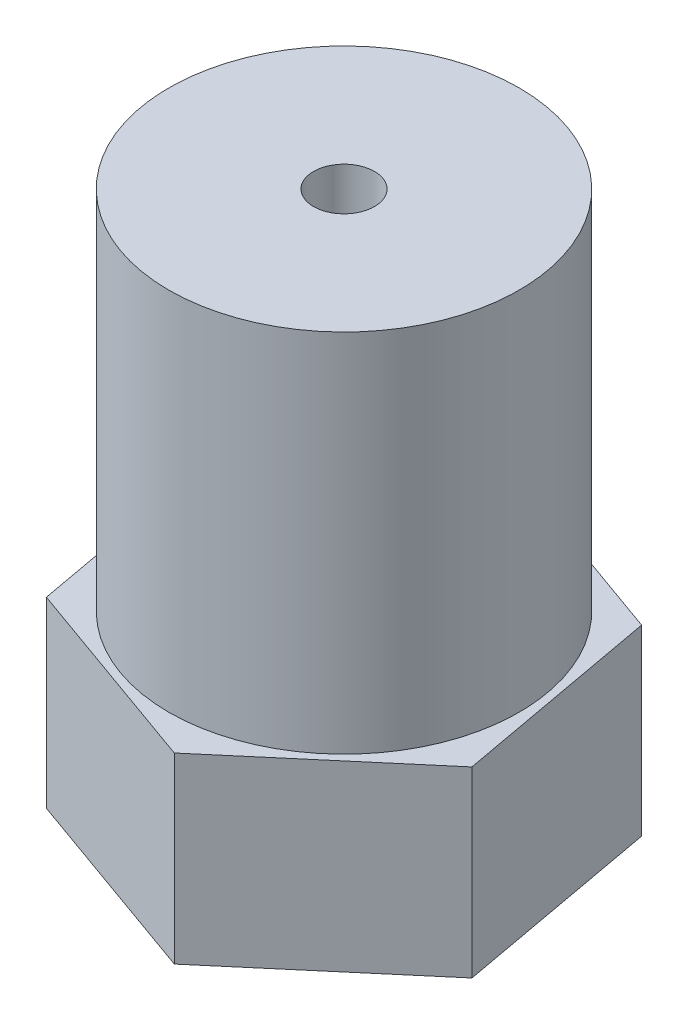
from build123d import *

# Parameters (mm, degrees)
EXTRUDE_1_DEPTH     = 6
SKETCH_2_R          = 2
CUT_EXTRUDE_1_DEPTH = 6
SKETCH_3_R          = 5.75
EXTRUDE_2_DEPTH     = 12
SKETCH_4_R          = 1
CUT_EXTRUDE_2_DEPTH = 12


with BuildPart() as part:
    # 草图1 → 凸台-拉伸1 (new body)
    with BuildSketch(Plane(origin=(0, 0, 0), x_dir=(1, 0, 0), z_dir=(0, 1, 0))):
        Polygon((5.280239472, 4.488203551), (-1.246778557, 6.816923297), (-6.527018029, 2.328719745), (-5.280239472, -4.488203551), (1.246778557, -6.816923297), (6.527018029, -2.328719745), align=None)
    extrude(amount=EXTRUDE_1_DEPTH)

    # 草图2 → 切除-拉伸1 (cut)
    with BuildSketch(Plane(origin=(0, 6, 0), x_dir=(1, 0, 0), z_dir=(0, 1, 0))):
        with Locations(Location((0, 0, 0), (0, 0, 270))):
            Circle(SKETCH_2_R)
    extrude(amount=-CUT_EXTRUDE_1_DEPTH, mode=Mode.SUBTRACT)

    # 草图3 → 凸台-拉伸2 (add)
    with BuildSketch(Plane(origin=(0, 6, 0), x_dir=(1, 0, 0), z_dir=(0, 1, 0))):
        with Locations(Location((0, 0, 0), (0, 0, 270))):
            Circle(SKETCH_3_R)
    extrude(amount=EXTRUDE_2_DEPTH)

    # 草图4 → 切除-拉伸2 (cut)
    with BuildSketch(Plane(origin=(0, 18, 0), x_dir=(1, 0, 0), z_dir=(0, 1, 0))):
        with Locations(Location((0, 0, 0), (0, 0, 270))):
            Circle(SKETCH_4_R)
    extrude(amount=-CUT_EXTRUDE_2_DEPTH, mode=Mode.SUBTRACT)


solid = part.part
